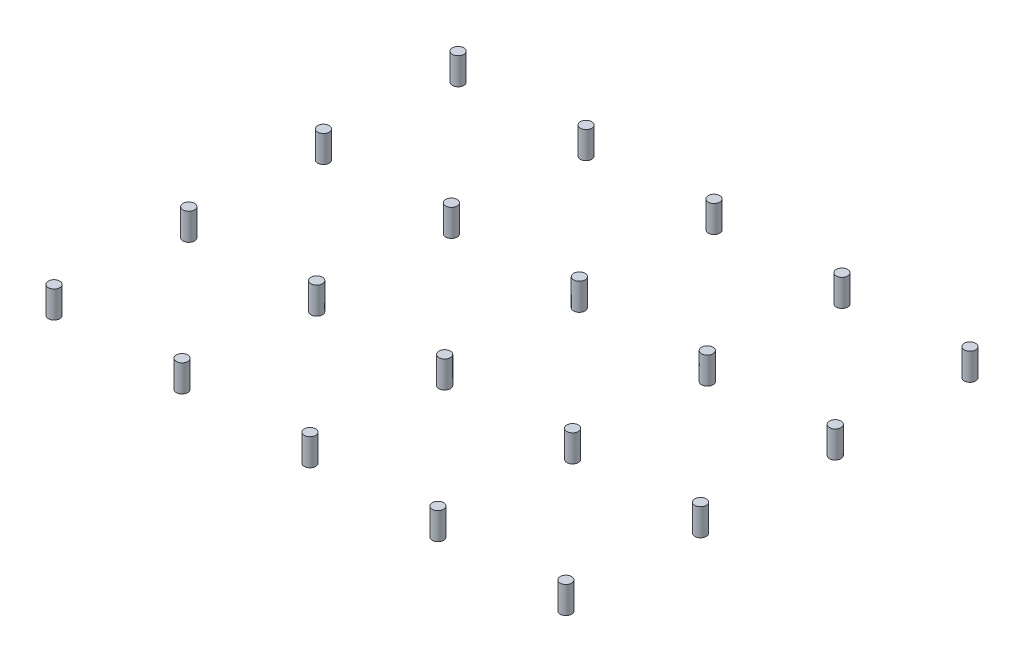
from build123d import *

# Parameters (mm, degrees)
SKETCH3_R              = 0.425
BOSS_EXTRUDE1_DEPTH    = 2
BOSS_EXTRUDE1_2_DEPTH  = 2
BOSS_EXTRUDE1_3_DEPTH  = 2
BOSS_EXTRUDE1_4_DEPTH  = 2
BOSS_EXTRUDE1_5_DEPTH  = 2
BOSS_EXTRUDE1_6_DEPTH  = 2
BOSS_EXTRUDE1_7_DEPTH  = 2
BOSS_EXTRUDE1_8_DEPTH  = 2
BOSS_EXTRUDE1_9_DEPTH  = 2
BOSS_EXTRUDE1_10_DEPTH = 2
BOSS_EXTRUDE1_11_DEPTH = 2
BOSS_EXTRUDE1_12_DEPTH = 2
BOSS_EXTRUDE1_13_DEPTH = 2
BOSS_EXTRUDE1_14_DEPTH = 2
BOSS_EXTRUDE1_15_DEPTH = 2
BOSS_EXTRUDE1_16_DEPTH = 2
BOSS_EXTRUDE1_17_DEPTH = 2
BOSS_EXTRUDE1_18_DEPTH = 2
BOSS_EXTRUDE1_19_DEPTH = 2
BOSS_EXTRUDE1_20_DEPTH = 2


with BuildPart() as part:
    # Sketch3 → Boss-Extrude1 (new body)
    with BuildSketch(Plane(origin=(0, 0, 0), x_dir=(1, 0, 0), z_dir=(0, 1, 0))):
        with Locations(Location((-39, 5, 0), (0, 0, 270))):
            Circle(SKETCH3_R)
    extrude(amount=BOSS_EXTRUDE1_DEPTH)


with BuildPart() as body_2:
    # Sketch3 → Boss-Extrude1 2 (new body)
    with BuildSketch(Plane(origin=(0, 0, 0), x_dir=(1, 0, 0), z_dir=(0, 1, 0))):
        with Locations(Location((-29.5, 5, 0), (0, 0, 270))):
            Circle(SKETCH3_R)
    extrude(amount=BOSS_EXTRUDE1_2_DEPTH)


with BuildPart() as body_3:
    # Sketch3 → Boss-Extrude1 3 (new body)
    with BuildSketch(Plane(origin=(0, 0, 0), x_dir=(1, 0, 0), z_dir=(0, 1, 0))):
        with Locations(Location((-20, 5, 0), (0, 0, 270))):
            Circle(SKETCH3_R)
    extrude(amount=BOSS_EXTRUDE1_3_DEPTH)


with BuildPart() as body_4:
    # Sketch3 → Boss-Extrude1 4 (new body)
    with BuildSketch(Plane(origin=(0, 0, 0), x_dir=(1, 0, 0), z_dir=(0, 1, 0))):
        with Locations(Location((-10.5, 5, 0), (0, 0, 270))):
            Circle(SKETCH3_R)
    extrude(amount=BOSS_EXTRUDE1_4_DEPTH)


with BuildPart() as body_5:
    # Sketch3 → Boss-Extrude1 5 (new body)
    with BuildSketch(Plane(origin=(0, 0, 0), x_dir=(1, 0, 0), z_dir=(0, 1, 0))):
        with Locations(Location((-1, 5, 0), (0, 0, 270))):
            Circle(SKETCH3_R)
    extrude(amount=BOSS_EXTRUDE1_5_DEPTH)


with BuildPart() as body_6:
    # Sketch3 → Boss-Extrude1 6 (new body)
    with BuildSketch(Plane(origin=(0, 0, 0), x_dir=(1, 0, 0), z_dir=(0, 1, 0))):
        with Locations(Location((-29.5, 15, 0), (0, 0, 270))):
            Circle(SKETCH3_R)
    extrude(amount=BOSS_EXTRUDE1_6_DEPTH)


with BuildPart() as body_7:
    # Sketch3 → Boss-Extrude1 7 (new body)
    with BuildSketch(Plane(origin=(0, 0, 0), x_dir=(1, 0, 0), z_dir=(0, 1, 0))):
        with Locations(Location((-20, 15, 0), (0, 0, 270))):
            Circle(SKETCH3_R)
    extrude(amount=BOSS_EXTRUDE1_7_DEPTH)


with BuildPart() as body_8:
    # Sketch3 → Boss-Extrude1 8 (new body)
    with BuildSketch(Plane(origin=(0, 0, 0), x_dir=(1, 0, 0), z_dir=(0, 1, 0))):
        with Locations(Location((-10.5, 15, 0), (0, 0, 270))):
            Circle(SKETCH3_R)
    extrude(amount=BOSS_EXTRUDE1_8_DEPTH)


with BuildPart() as body_9:
    # Sketch3 → Boss-Extrude1 9 (new body)
    with BuildSketch(Plane(origin=(0, 0, 0), x_dir=(1, 0, 0), z_dir=(0, 1, 0))):
        with Locations(Location((-1, 15, 0), (0, 0, 270))):
            Circle(SKETCH3_R)
    extrude(amount=BOSS_EXTRUDE1_9_DEPTH)


with BuildPart() as body_10:
    # Sketch3 → Boss-Extrude1 10 (new body)
    with BuildSketch(Plane(origin=(0, 0, 0), x_dir=(1, 0, 0), z_dir=(0, 1, 0))):
        with Locations(Location((-29.5, 25, 0), (0, 0, 270))):
            Circle(SKETCH3_R)
    extrude(amount=BOSS_EXTRUDE1_10_DEPTH)


with BuildPart() as body_11:
    # Sketch3 → Boss-Extrude1 11 (new body)
    with BuildSketch(Plane(origin=(0, 0, 0), x_dir=(1, 0, 0), z_dir=(0, 1, 0))):
        with Locations(Location((-20, 25, 0), (0, 0, 270))):
            Circle(SKETCH3_R)
    extrude(amount=BOSS_EXTRUDE1_11_DEPTH)


with BuildPart() as body_12:
    # Sketch3 → Boss-Extrude1 12 (new body)
    with BuildSketch(Plane(origin=(0, 0, 0), x_dir=(1, 0, 0), z_dir=(0, 1, 0))):
        with Locations(Location((-10.5, 25, 0), (0, 0, 270))):
            Circle(SKETCH3_R)
    extrude(amount=BOSS_EXTRUDE1_12_DEPTH)


with BuildPart() as body_13:
    # Sketch3 → Boss-Extrude1 13 (new body)
    with BuildSketch(Plane(origin=(0, 0, 0), x_dir=(1, 0, 0), z_dir=(0, 1, 0))):
        with Locations(Location((-1, 25, 0), (0, 0, 270))):
            Circle(SKETCH3_R)
    extrude(amount=BOSS_EXTRUDE1_13_DEPTH)


with BuildPart() as body_14:
    # Sketch3 → Boss-Extrude1 14 (new body)
    with BuildSketch(Plane(origin=(0, 0, 0), x_dir=(1, 0, 0), z_dir=(0, 1, 0))):
        with Locations(Location((-29.5, 35, 0), (0, 0, 270))):
            Circle(SKETCH3_R)
    extrude(amount=BOSS_EXTRUDE1_14_DEPTH)


with BuildPart() as body_15:
    # Sketch3 → Boss-Extrude1 15 (new body)
    with BuildSketch(Plane(origin=(0, 0, 0), x_dir=(1, 0, 0), z_dir=(0, 1, 0))):
        with Locations(Location((-20, 35, 0), (0, 0, 270))):
            Circle(SKETCH3_R)
    extrude(amount=BOSS_EXTRUDE1_15_DEPTH)


with BuildPart() as body_16:
    # Sketch3 → Boss-Extrude1 16 (new body)
    with BuildSketch(Plane(origin=(0, 0, 0), x_dir=(1, 0, 0), z_dir=(0, 1, 0))):
        with Locations(Location((-10.5, 35, 0), (0, 0, 270))):
            Circle(SKETCH3_R)
    extrude(amount=BOSS_EXTRUDE1_16_DEPTH)


with BuildPart() as body_17:
    # Sketch3 → Boss-Extrude1 17 (new body)
    with BuildSketch(Plane(origin=(0, 0, 0), x_dir=(1, 0, 0), z_dir=(0, 1, 0))):
        with Locations(Location((-1, 35, 0), (0, 0, 270))):
            Circle(SKETCH3_R)
    extrude(amount=BOSS_EXTRUDE1_17_DEPTH)


with BuildPart() as body_18:
    # Sketch3 → Boss-Extrude1 18 (new body)
    with BuildSketch(Plane(origin=(0, 0, 0), x_dir=(1, 0, 0), z_dir=(0, 1, 0))):
        with Locations(Location((-39, 15, 0), (0, 0, 270))):
            Circle(SKETCH3_R)
    extrude(amount=BOSS_EXTRUDE1_18_DEPTH)


with BuildPart() as body_19:
    # Sketch3 → Boss-Extrude1 19 (new body)
    with BuildSketch(Plane(origin=(0, 0, 0), x_dir=(1, 0, 0), z_dir=(0, 1, 0))):
        with Locations(Location((-39, 25, 0), (0, 0, 270))):
            Circle(SKETCH3_R)
    extrude(amount=BOSS_EXTRUDE1_19_DEPTH)


with BuildPart() as body_20:
    # Sketch3 → Boss-Extrude1 20 (new body)
    with BuildSketch(Plane(origin=(0, 0, 0), x_dir=(1, 0, 0), z_dir=(0, 1, 0))):
        with Locations(Location((-39, 35, 0), (0, 0, 270))):
            Circle(SKETCH3_R)
    extrude(amount=BOSS_EXTRUDE1_20_DEPTH)


solid = Compound([part.part, body_2.part, body_3.part, body_4.part, body_5.part, body_6.part, body_7.part, body_8.part, body_9.part, body_10.part, body_11.part, body_12.part, body_13.part, body_14.part, body_15.part, body_16.part, body_17.part, body_18.part, body_19.part, body_20.part])
